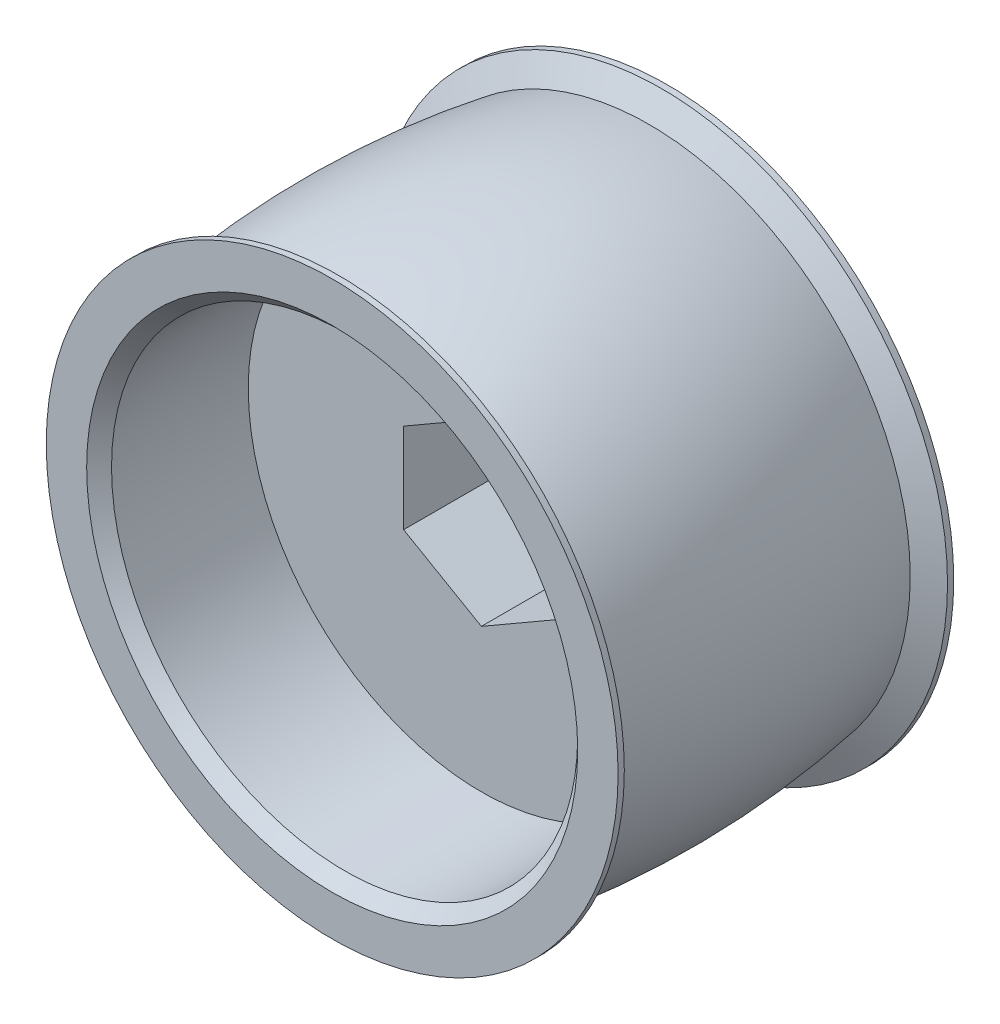
from build123d import *

# Parameters (mm, degrees)
ESQUISSE1_R             = 23
ESQUISSE1_R_2           = 2.15
BOSS_EXTRU_1_DEPTH      = 15
ESQUISSE2_R             = 23
ESQUISSE2_R_2           = 18.75
BOSS_EXTRU_2_DEPTH      = 12
ENL_V_MAT_EXTRU_9_DEPTH = 13
CHANFREIN1_SIZE         = 1


with BuildPart() as part:
    # Esquisse1 → Boss.-Extru.1 (new body)
    with BuildSketch(Plane.XY):
        Circle(ESQUISSE1_R)
        Circle(ESQUISSE1_R_2, mode=Mode.SUBTRACT)
    extrude(amount=BOSS_EXTRU_1_DEPTH)

    # Esquisse2 → Boss.-Extru.2 (add)
    with BuildSketch(Plane.XY.offset(15)):
        Circle(ESQUISSE2_R)
        Circle(ESQUISSE2_R_2, mode=Mode.SUBTRACT)
    extrude(amount=BOSS_EXTRU_2_DEPTH)

    # Esquisse9 → Enlèv. mat.-Extru.9 (cut)
    with BuildSketch(Plane.XY.offset(15)):
        Polygon((6.25, -3.608439182), (6.25, 3.608439182), (0, 7.216878365), (-6.25, 3.608439182), (-6.25, -3.608439182), (0, -7.216878365), align=None)
    extrude(amount=-ENL_V_MAT_EXTRU_9_DEPTH, mode=Mode.SUBTRACT)

    # Chanfrein1
    chanfrein1_edges = [part.edges().sort_by_distance(p)[0] for p in [
        (-18.75, 0, 27),
    ]]
    chamfer(chanfrein1_edges, length=CHANFREIN1_SIZE)

    # Esquisse10 → Enlèvement de matière-Révolution1 (revolve, cut)
    with BuildSketch(Plane(origin=(0, 0, 0), x_dir=(0, 0, -1), z_dir=(1, 0, 0)), mode=Mode.PRIVATE) as enl_vement_de_mati_re_r_volution1_sk:
        with BuildLine():
            Line((-26.5, 23), (-0.5, 23))
            Line((-0.5, 23), (-1.5, 21))
            ThreePointArc((-1.5, 21), (-13.5, 22), (-25.5, 21))
            Line((-25.5, 21), (-26.5, 23))
        make_face()
    revolve(enl_vement_de_mati_re_r_volution1_sk.sketch.rotate(Axis((0, 0, 0), (0, 0, 1)), 90), axis=Axis((0, 0, 0), (0, 0, 1)), mode=Mode.SUBTRACT)


solid = part.part
